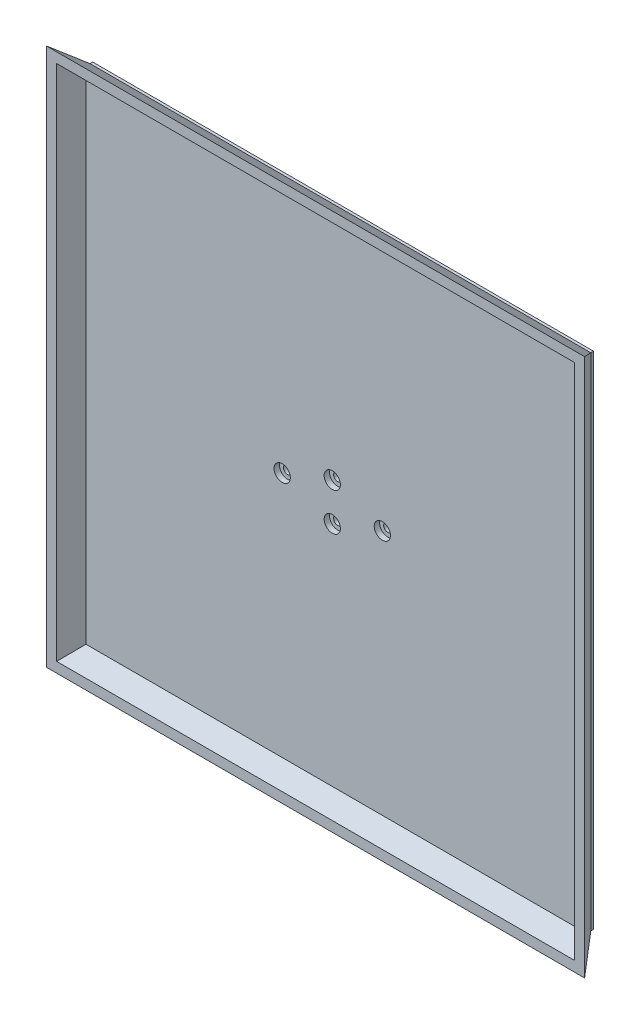
from build123d import *

# Parameters (mm, degrees)
SHELL_2_T            = -3
SKETCH_4_R           = 1.5
CUT_EXTRUDE_1_DEPTH  = 10
EXTRUDE_1_DEPTH      = 40.5
CUT_EXTRUDE_2_DEPTH  = 100
SKETCH_8_R           = 1.5
EXTRUDE_2_DEPTH      = 3
EXTRUDE_3_DEPTH      = 4
EXTRUDE_4_DEPTH      = 4
SKETCH_11_W          = 56.2
SKETCH_11_H          = 25
CUT_EXTRUDE_3_DEPTH  = 4
SKETCH_12_W          = 3
SKETCH_12_H          = 215
EXTRUDE_5_DEPTH      = 10
SKETCH_13_W          = 10
SKETCH_13_H          = 215
CUT_EXTRUDE_4_DEPTH  = 300
SKETCH_15_W          = 116.702064096
SKETCH_15_H          = 65.174269722
SKETCH_15_W_2        = 111.85
SKETCH_15_H_2        = 80
CUT_EXTRUDE_5_DEPTH  = 4
SKETCH_16_W          = 185
SKETCH_16_H          = 185
EXTRUDE_6_DEPTH      = 4
SKETCH_17_W          = 56.2
SKETCH_17_H          = 25
CUT_EXTRUDE_6_DEPTH  = 4
EXTRUDE_7_DEPTH      = 4
SKETCH_20_R          = 1.5
CUT_EXTRUDE_7_DEPTH  = 10
SKETCH_21_W          = 185
SKETCH_21_H          = 185
CUT_EXTRUDE_8_DEPTH  = 37.5
EXTRUDE_START        = 1
SKETCH_22_W          = 185
SKETCH_22_H          = 185
SKETCH_22_R          = 1.5
EXTRUDE_8_DEPTH      = 1
CUT_EXTRUDE_START    = -2
SKETCH_24_R          = 3
SKETCH_24_R_2        = 1.5
CUT_EXTRUDE_9_DEPTH  = 2
SKETCH_25_R          = 1.51
CUT_EXTRUDE_10_DEPTH = 10
SKETCH_26_R          = 1.5
EXTRUDE_9_DEPTH      = 4
EXTRUDE_START_2      = -4
SKETCH_28_R          = 3
EXTRUDE_10_DEPTH     = 4
SKETCH_29_R          = 3
CUT_EXTRUDE_11_DEPTH = 2
CUT_EXTRUDE_12_DEPTH = 10
CUT_EXTRUDE_13_DEPTH = 10
CUT_EXTRUDE_14_DEPTH = 10
CUT_EXTRUDE_15_DEPTH = 10
CUT_EXTRUDE_19_DEPTH = 200
CUT_EXTRUDE_20_DEPTH = 200


with BuildPart() as part:
    # 草图3 → 放样1 section 0
    with BuildSketch(Plane.XY.offset(20)):
        with BuildLine():
            Line((-32.460246779, 32.274755465), (182.539753221, 32.274755465))
            Line((182.539753221, 32.274755465), (182.539753221, -182.725244535))
            Line((182.539753221, -182.725244535), (-32.460246779, -182.725244535))
            Line((-32.460246779, -182.725244535), (-32.460246779, 32.274755465))
        make_face()
    # 草图1 → 放样1 section 1
    with BuildSketch(Plane.XY):
        with BuildLine():
            Line((-17.5, -167.5), (167.5, -167.5))
            Line((167.5, -167.5), (167.5, 17.5))
            Line((167.5, 17.5), (-17.5, 17.5))
            Line((-17.5, 17.5), (-17.5, -167.5))
        make_face()
    loft()

    # 抽壳2
    shell_2_openings = [part.faces().sort_by_distance(p)[0] for p in [
        (75.039753221, -75.225244535, 20),
    ]]
    offset(amount=SHELL_2_T, openings=shell_2_openings, kind=Kind.INTERSECTION)

    # 草图4 → 切除-拉伸1 (cut)
    with BuildSketch(Plane.XY.offset(3)):
        with BuildLine():
            ThreePointArc((86.25, -75.225244535), (84.75, -73.725244535), (83.25, -75.225244535))
            Line((83.25, -75.225244535), (86.25, -75.225244535))
        make_face()
        with BuildLine():
            Line((86.25, -75.225244535), (83.25, -75.225244535))
            ThreePointArc((83.25, -75.225244535), (84.75, -76.725244535), (86.25, -75.225244535))
        make_face()
        with Locations((66.25, -82.225244535)):
            Circle(SKETCH_4_R)
        with BuildLine():
            ThreePointArc((74.75, -75.225244535), (73.25, -73.725244535), (71.75, -75.225244535))
            Line((71.75, -75.225244535), (74.75, -75.225244535))
        make_face()
        with BuildLine():
            Line((74.75, -75.225244535), (71.75, -75.225244535))
            ThreePointArc((71.75, -75.225244535), (73.25, -76.725244535), (74.75, -75.225244535))
        make_face()
        with Locations((66.25, -68.225244535)):
            Circle(SKETCH_4_R)
        with BuildLine():
            ThreePointArc((60.75, -75.225244535), (59.25, -73.725244535), (57.75, -75.225244535))
            Line((57.75, -75.225244535), (60.75, -75.225244535))
        make_face()
        with BuildLine():
            Line((60.75, -75.225244535), (57.75, -75.225244535))
            ThreePointArc((57.75, -75.225244535), (59.25, -76.725244535), (60.75, -75.225244535))
        make_face()
        with BuildLine():
            ThreePointArc((49.25, -75.225244535), (47.75, -73.725244535), (46.25, -75.225244535))
            Line((46.25, -75.225244535), (49.25, -75.225244535))
        make_face()
        with BuildLine():
            Line((49.25, -75.225244535), (46.25, -75.225244535))
            ThreePointArc((46.25, -75.225244535), (47.75, -76.725244535), (49.25, -75.225244535))
        make_face()
    extrude(amount=-CUT_EXTRUDE_1_DEPTH, mode=Mode.SUBTRACT)

    # 草图6 → 凸台-拉伸1 (add)
    with BuildSketch(Plane.XY.offset(3)):
        Polygon((38.15, -62.5), (34.15, -62.5), (31.15, -62.5), (31.15, -65.5), (34.15, -65.5), (34.15, -84.5), (31.15, -84.5), (31.15, -87.5), (34.15, -87.5), (38.15, -87.5), (38.15, -75), align=None)
        Polygon((94.35, -75), (94.35, -62.5), (98.35, -62.5), (101.35, -62.5), (101.35, -65.5), (98.35, -65.5), (98.35, -84.5), (101.35, -84.5), (101.35, -87.5), (98.35, -87.5), (94.35, -87.5), align=None)
    extrude(amount=-EXTRUDE_1_DEPTH)

    # 草图7 → 切除-拉伸2 (cut)
    with BuildSketch(Plane(origin=(98.35, 0, 0), x_dir=(0, 0, -1), z_dir=(1, 0, 0))):
        with BuildLine():
            ThreePointArc((18.01, -75), (16.5, -73.49), (14.99, -75))
            Line((14.99, -75), (16.5, -75))
            Line((16.5, -75), (18.01, -75))
        make_face()
        with BuildLine():
            Line((16.5, -75), (14.99, -75))
            ThreePointArc((14.99, -75), (16.5, -76.51), (18.01, -75))
            Line((18.01, -75), (16.5, -75))
        make_face()
        with BuildLine():
            ThreePointArc((35.01, -75), (33.5, -73.49), (31.99, -75))
            Line((31.99, -75), (33.5, -75))
            Line((33.5, -75), (35.01, -75))
        make_face()
        with BuildLine():
            Line((33.5, -75), (31.99, -75))
            ThreePointArc((31.99, -75), (33.5, -76.51), (35.01, -75))
            Line((35.01, -75), (33.5, -75))
        make_face()
    extrude(amount=-CUT_EXTRUDE_2_DEPTH, mode=Mode.SUBTRACT)

    # 草图8 → 凸台-拉伸2 (add)
    with BuildSketch(Plane.XY.offset(3)):
        with Locations((66.25, -68.225244535)):
            Circle(SKETCH_8_R)
        with Locations((59.25, -75.225244535)):
            Circle(SKETCH_8_R)
        with Locations((47.75, -75.225244535)):
            Circle(SKETCH_8_R)
        with Locations((73.25, -75.225244535)):
            Circle(SKETCH_8_R)
        with Locations((84.75, -75.225244535)):
            Circle(SKETCH_8_R)
        with Locations((66.25, -82.225244535)):
            Circle(SKETCH_8_R)
    extrude(amount=-EXTRUDE_2_DEPTH)

    # 草图9 → 凸台-拉伸3 (add)
    with BuildSketch(Plane(origin=(0, 0, 0), x_dir=(-1, 0, 0), z_dir=(0, 0, -1))):
        Polygon((-73.585786438, -76.414213562), (0, -2.828427125), (0, 0), (-2.828427125, 0), (-72.748638048, -69.920210924), (-150, -147.171572875), (-150, -150), (-147.171572875, -150), align=None)
    extrude(amount=EXTRUDE_3_DEPTH)

    # 草图10 → 凸台-拉伸4 (add)
    with BuildSketch(Plane(origin=(0, 0, 0), x_dir=(-1, 0, 0), z_dir=(0, 0, -1))):
        Polygon((-106.669297814, -40.502275062), (-147.171572875, 17.5), (-167.5, 17.5), (-167.5, 34.342276425), (-121.973814525, -30.8546126), (-26.55602168, -167.5), (17.5, -167.5), (17.5, -218.321959389), align=None)
    extrude(amount=EXTRUDE_4_DEPTH)

    # 草图11 → 切除-拉伸3 (cut)
    with BuildSketch(Plane(origin=(0, 0, -4), x_dir=(-1, 0, 0), z_dir=(0, 0, -1))):
        with Locations((-66.25, -75)):
            Rectangle(SKETCH_11_W, SKETCH_11_H)
    extrude(amount=-CUT_EXTRUDE_3_DEPTH, mode=Mode.SUBTRACT)


with BuildPart() as body_2:
    # 草图12 → 凸台-拉伸5 (new body)
    with BuildSketch(Plane.XY.offset(20)):
        with Locations((184.039753221, -75.225244535)):
            Rectangle(SKETCH_12_W, SKETCH_12_H)
    extrude(amount=-EXTRUDE_5_DEPTH)


with BuildPart() as cut_extrude_4_tool:
    # 草图13 → 切除-拉伸4 (new body)
    with BuildSketch(Plane(origin=(185.539753221, 0, 0), x_dir=(0, 0, -1), z_dir=(1, 0, 0))):
        with Locations((-15, -75.225244535)):
            Rectangle(SKETCH_13_W, SKETCH_13_H)
    extrude(amount=-CUT_EXTRUDE_4_DEPTH)


with BuildPart() as part_1:
    add(part.part)

    # 切除-拉伸4: cut by cut_extrude_4_tool
    add(cut_extrude_4_tool.part, mode=Mode.SUBTRACT)

    # 草图15 → 切除-拉伸5 (cut)
    with BuildSketch(Plane(origin=(0, 0, -4), x_dir=(-1, 0, 0), z_dir=(0, 0, -1))):
        with Locations((-96.501032048, -120.087134861)):
            Rectangle(SKETCH_15_W, SKETCH_15_H)
        with Locations((-38.425, -22.5)):
            Rectangle(SKETCH_15_W_2, SKETCH_15_H_2)
    extrude(amount=-CUT_EXTRUDE_5_DEPTH, mode=Mode.SUBTRACT)

    # 草图16 → 凸台-拉伸6 (add)
    with BuildSketch(Plane(origin=(0, 0, 0), x_dir=(-1, 0, 0), z_dir=(0, 0, -1))):
        with Locations((-75, -75)):
            Rectangle(SKETCH_16_W, SKETCH_16_H)
        Polygon((-94.35, -62.5), (-94.35, -70.413972806), (-99.876229843, -62.5), align=None, mode=Mode.SUBTRACT)
        Polygon((-31.15, -62.5), (-31.15, -65.5), (-34.15, -65.5), (-34.15, -84.5), (-31.15, -84.5), (-31.15, -87.5), (-38.15, -87.5), (-38.15, -62.5), align=None, mode=Mode.SUBTRACT)
    extrude(amount=EXTRUDE_6_DEPTH)

    # 草图17 → 切除-拉伸6 (cut)
    with BuildSketch(Plane(origin=(0, 0, 0), x_dir=(-1, 0, 0), z_dir=(0, 0, -1))):
        with Locations((-66.25, -75)):
            Rectangle(SKETCH_17_W, SKETCH_17_H)
    extrude(amount=CUT_EXTRUDE_6_DEPTH, mode=Mode.SUBTRACT)

    # 草图18 → 凸台-拉伸7 (add)
    with BuildSketch(Plane(origin=(0, 0, 0), x_dir=(-1, 0, 0), z_dir=(0, 0, -1))):
        Polygon((-75, -119.25), (-33.578427125, -119.25), (-31.578427125, -121.25), (-29.578427125, -123.25), (-75, -123.25), (-120.421572875, -123.25), (-116.421572875, -119.25), align=None)
        Polygon((-119.25, -75), (-119.25, -116.421572875), (-121.25, -118.421572875), (-123.25, -120.421572875), (-123.25, -75), (-123.25, -29.578427125), (-119.25, -33.578427125), align=None)
        Polygon((-75, -30.75), (-116.421572875, -30.75), (-120.421572875, -26.75), (-75, -26.75), (-29.578427125, -26.75), (-33.578427125, -30.75), align=None)
        Polygon((-30.75, -33.578427125), (-26.75, -29.578427125), (-26.75, -75), (-26.75, -120.421572875), (-30.75, -116.421572875), (-30.75, -75), align=None)
    extrude(amount=EXTRUDE_7_DEPTH)

    # 草图20 → 切除-拉伸7 (cut)
    with BuildSketch(Plane(origin=(0, 0, 0), x_dir=(-1, 0, 0), z_dir=(0, 0, -1))):
        with Locations((-84.75, -75)):
            Circle(SKETCH_20_R)
        with Locations((-47.75, -75)):
            Circle(SKETCH_20_R)
        with Locations((-66.25, -68)):
            Circle(SKETCH_20_R)
        with Locations((-66.25, -82)):
            Circle(SKETCH_20_R)
    extrude(amount=-CUT_EXTRUDE_7_DEPTH, mode=Mode.SUBTRACT)

    # 草图21 → 切除-拉伸8 (cut)
    with BuildSketch(Plane(origin=(0, 0, -37.5), x_dir=(-1, 0, 0), z_dir=(0, 0, -1))):
        with Locations((-75, -75)):
            Rectangle(SKETCH_21_W, SKETCH_21_H)
    extrude(amount=-CUT_EXTRUDE_8_DEPTH, mode=Mode.SUBTRACT)

    # 草图22 → 凸台-拉伸8 (add)
    with BuildSketch(Plane(origin=(0, 0, 0), x_dir=(-1, 0, 0), z_dir=(0, 0, -1)).offset(EXTRUDE_START)):
        with Locations((-75, -75)):
            Rectangle(SKETCH_22_W, SKETCH_22_H)
        with Locations((-66.25, -68)):
            Circle(SKETCH_22_R, mode=Mode.SUBTRACT)
        with Locations((-66.25, -82)):
            Circle(SKETCH_22_R, mode=Mode.SUBTRACT)
        with Locations((-84.75, -75)):
            Circle(SKETCH_22_R, mode=Mode.SUBTRACT)
        with Locations((-47.75, -75)):
            Circle(SKETCH_22_R, mode=Mode.SUBTRACT)
    extrude(amount=-EXTRUDE_8_DEPTH)

    # 草图24 → 切除-拉伸9 (cut)
    # profile 1 of 4: a face of its own
    with BuildSketch(Plane.XY.offset(3).offset(CUT_EXTRUDE_START)):
        with Locations((66.25, -68)):
            Circle(SKETCH_24_R)
        with Locations((66.25, -68)):
            Circle(SKETCH_24_R_2, mode=Mode.SUBTRACT)
    # profile 2 of 4: a face of its own
    with BuildSketch(Plane.XY.offset(3).offset(CUT_EXTRUDE_START)):
        with Locations((66.25, -82)):
            Circle(SKETCH_24_R)
        with Locations((66.25, -82)):
            Circle(SKETCH_24_R_2, mode=Mode.SUBTRACT)
    # profile 3 of 4: a face of its own
    with BuildSketch(Plane.XY.offset(3).offset(CUT_EXTRUDE_START)):
        with Locations((84.75, -75)):
            Circle(SKETCH_24_R)
        with Locations((84.75, -75)):
            Circle(SKETCH_24_R_2, mode=Mode.SUBTRACT)
    # profile 4 of 4: a face of its own
    with BuildSketch(Plane.XY.offset(3).offset(CUT_EXTRUDE_START)):
        with Locations((47.75, -75)):
            Circle(SKETCH_24_R)
    extrude(amount=CUT_EXTRUDE_9_DEPTH, mode=Mode.SUBTRACT)

    # 草图25 → 切除-拉伸10 (cut)
    with BuildSketch(Plane(origin=(0, 0, -1), x_dir=(-1, 0, 0), z_dir=(0, 0, -1))):
        with Locations((-75, -68)):
            Circle(SKETCH_25_R)
        with Locations((-75, -82)):
            Circle(SKETCH_25_R)
        with Locations((-93.5, -75)):
            Circle(SKETCH_25_R)
        with Locations((-56.5, -75)):
            Circle(SKETCH_25_R)
    extrude(amount=-CUT_EXTRUDE_10_DEPTH, mode=Mode.SUBTRACT)

    # 草图26 → 凸台-拉伸9 (add)
    with BuildSketch(Plane(origin=(0, 0, -1), x_dir=(-1, 0, 0), z_dir=(0, 0, -1))):
        with Locations((-84.75, -75)):
            Circle(SKETCH_26_R)
        with Locations((-66.25, -68)):
            Circle(SKETCH_26_R)
        with Locations((-66.25, -82)):
            Circle(SKETCH_26_R)
        with Locations((-47.75, -75)):
            Circle(SKETCH_26_R)
    extrude(amount=-EXTRUDE_9_DEPTH)

    # 草图28 → 凸台-拉伸10 (add)
    with BuildSketch(Plane.XY.offset(3).offset(EXTRUDE_START_2)):
        with Locations((84.75, -75)):
            Circle(SKETCH_28_R)
        with Locations((66.25, -68)):
            Circle(SKETCH_28_R)
        with Locations((47.75, -75)):
            Circle(SKETCH_28_R)
        with Locations((66.25, -82)):
            Circle(SKETCH_28_R)
    extrude(amount=EXTRUDE_10_DEPTH)

    # 草图29 → 切除-拉伸11 (cut)
    with BuildSketch(Plane.XY.offset(3)):
        with Locations((75, -68)):
            Circle(SKETCH_29_R)
        with Locations((75, -82)):
            Circle(SKETCH_29_R)
        with Locations((93.5, -75)):
            Circle(SKETCH_29_R)
        with Locations((56.5, -75)):
            Circle(SKETCH_29_R)
    extrude(amount=-CUT_EXTRUDE_11_DEPTH, mode=Mode.SUBTRACT)

    # 草图30 → 切除-拉伸12 (cut)
    with BuildSketch(Plane(origin=(-11.221383762, 0, -8.393733514), x_dir=(-0.5989808600970753, 0, 0.8007633415918638), z_dir=(-0.8007633415918638, 0, -0.5989808600970753))):
        Polygon((21.970249209, 24.295823605), (22.970249209, 24.887377733), (22.970249209, 25.521543856), (21.970249209, 25.521543856), align=None)
        Polygon((21.970249209, 23.212591773), (22.970249209, 23.212591773), (22.970249209, 24.887377733), (21.970249209, 24.295823605), align=None)
        Polygon((22.970249209, -175.112622267), (22.970249209, 23.212591773), (21.970249209, 23.212591773), (21.970249209, -174.503031383), align=None)
        Polygon((24.472936447, 23.212591773), (22.970249209, 23.212591773), (22.970249209, -175.112622267), (21.970249209, -174.503031383), (21.970249209, -177.376097461), (24.472936447, -177.376097461), align=None)
    extrude(amount=-CUT_EXTRUDE_12_DEPTH, mode=Mode.SUBTRACT)

    # 草图31 → 切除-拉伸13 (cut)
    with BuildSketch(Plane(origin=(0, 11.321485901, -8.363609284), x_dir=(1, 0, 0), z_dir=(0, 0.804327079908719, -0.5941867959871823))):
        Polygon((-9.362751303, -26.365830403), (-9.362751303, -22.831022035), (-23.310620962, -22.831022035), (-24.381142529, -21.835452742), (-24.378476809, -21.831022035), (-28.997349139, -21.831022035), (-28.997349139, -26.365830403), align=None)
        Polygon((175.01987661, -22.831022035), (-9.362751303, -22.831022035), (-9.362751303, -26.365830403), (-9.362751303, -29.913680828), (184.828261885, -29.913680828), (184.828261885, -21.831022035), (174.415032571, -21.831022035), align=None)
        Polygon((-23.310620962, -22.831022035), (-9.362751303, -22.831022035), (-9.362751303, -21.831022035), (-24.378476809, -21.831022035), (-24.381142529, -21.835452742), align=None)
        Polygon((-9.362751303, -21.831022035), (-9.362751303, -22.831022035), (175.01987661, -22.831022035), (174.415032571, -21.831022035), align=None)
    extrude(amount=-CUT_EXTRUDE_13_DEPTH, mode=Mode.SUBTRACT)

    # 草图32 → 切除-拉伸14 (cut)
    with BuildSketch(Plane(origin=(106.995565381, 0, -80.459344952), x_dir=(-0.6010162270612195, 0, -0.7992368202285832), z_dir=(0.7992368202285832, 0, -0.6010162270612195))):
        Polygon((-120.009855749, -69.723738659), (-113.182154103, -69.723738659), (-113.182154103, 23.204405296), (-112.182154103, 24.286300454), (-112.182154103, 28.147322854), (-120.009855749, 28.147322854), align=None)
        Polygon((-113.182154103, 23.204405296), (-113.182154103, -69.723738659), (-112.182154103, -69.723738659), (-112.182154103, 24.286300454), align=None)
        Polygon((-113.182154103, -175.112622267), (-113.182154103, -69.723738659), (-120.009855749, -69.723738659), (-120.009855749, -178.276095982), (-112.182154103, -178.276095982), (-112.182154103, -174.504193466), align=None)
        Polygon((-112.182154103, -69.723738659), (-113.182154103, -69.723738659), (-113.182154103, -175.112622267), (-112.182154103, -174.504193466), align=None)
    extrude(amount=-CUT_EXTRUDE_14_DEPTH, mode=Mode.SUBTRACT)

    # 草图33 → 切除-拉伸15 (cut)
    with BuildSketch(Plane(origin=(0, -106.044862451, -80.727948124), x_dir=(1, 0, 0), z_dir=(0, -0.7956781110640406, -0.6057196905942221))):
        Polygon((69.393478745, 118.677029152), (69.393478745, 114.02594449), (173.356028024, 114.02594449), (174.41412798, 113.02594449), (179.725148275, 113.02594449), (179.725148275, 118.677029152), align=None)
        Polygon((-23.310620962, 114.02594449), (69.393478745, 114.02594449), (69.393478745, 118.677029152), (69.393478745, 127.996312104), (-31.968712938, 127.996312104), (-31.968712938, 113.02594449), (-24.374344205, 113.02594449), align=None)
        Polygon((69.393478745, 113.02594449), (69.393478745, 114.02594449), (-23.310620962, 114.02594449), (-24.374344205, 113.02594449), align=None)
        Polygon((173.356028024, 114.02594449), (69.393478745, 114.02594449), (69.393478745, 113.02594449), (174.41412798, 113.02594449), align=None)
    extrude(amount=-CUT_EXTRUDE_15_DEPTH, mode=Mode.SUBTRACT)

    # 草图36 → 切除-拉伸19 (cut)
    with BuildSketch(Plane.ZY.offset(17.5)):
        Polygon((10.043413086, 23.204405296), (10, 23.204405296), (9.19, 23.204405296), (9.19, -174.807653439), (10.859055114, -174.807653439), (10.859055114, 23.204405296), align=None)
        Polygon((9.19, 23.204405296), (10, 23.204405296), (10.043413086, 23.204405296), (10.043413086, 24.45758786), (9.19, 24.45758786), align=None)
    extrude(amount=-CUT_EXTRUDE_19_DEPTH, mode=Mode.SUBTRACT)

    # 草图37 → 切除-拉伸20 (cut)
    with BuildSketch(Plane(origin=(-17.5, 0, 0), x_dir=(0, 0, -1), z_dir=(1, 0, 0))):
        Polygon((-9.204321889, -174.506902577), (-10, -173.461693603), (-10.120495689, -173.461693603), (-10.120495689, -174.637630453), (-9.19, -174.637630453), (-9.19, -174.495999864), align=None)
        Polygon((-9.19, -173.461693603), (-10, -173.461693603), (-9.204321889, -174.506902577), (-9.19, -174.495999864), align=None)
        Polygon((-10, -171.342253373), (-10, -173.461693603), (-9.19, -173.461693603), (-9.19, -170.725630969), align=None)
        Polygon((-10.120495689, -173.461693603), (-10, -173.461693603), (-10, -171.342253373), (-9.19, -170.725630969), (-9.19, 24.422433595), (-10.120495689, 24.422433595), align=None)
    extrude(amount=-CUT_EXTRUDE_20_DEPTH, mode=Mode.SUBTRACT)


with BuildPart() as body_2_1:
    add(body_2.part)

    # 切除-拉伸4: cut by cut_extrude_4_tool
    add(cut_extrude_4_tool.part, mode=Mode.SUBTRACT)


solid = part_1.part
